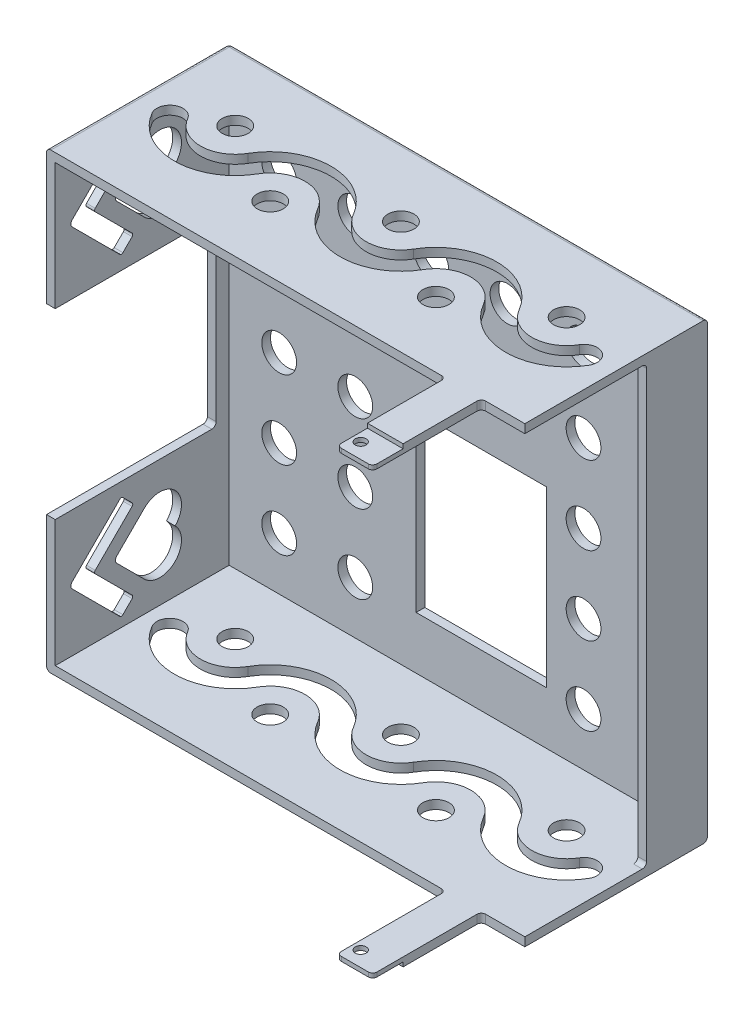
from build123d import *

# Parameters (mm, degrees)
SKETCH_5_W           = 115
SKETCH_5_H           = 104.2
EXTRUDE_2_DEPTH      = 42
SHELL_1_T            = -2
CUT_EXTRUDE_5_REACH  = 135.054
SKETCH_6_W           = 37
SKETCH_6_H           = 42
SKETCH_8_W           = 30
SKETCH_8_H           = 49
CUT_EXTRUDE_6_DEPTH  = 10
SKETCH_16_W          = 8.2
SKETCH_16_H          = 25
EXTRUDE_8_DEPTH      = 2
SKETCH_17_R          = 1.25
CUT_EXTRUDE_10_DEPTH = 10
SKETCH_18_W          = 8.2
SKETCH_18_H          = 7
CUT_EXTRUDE_11_DEPTH = 1
SKETCH_19_W          = 8.2
SKETCH_19_H          = 25
EXTRUDE_9_DEPTH      = 2
SKETCH_20_R          = 1.25
CUT_EXTRUDE_12_DEPTH = 2
SKETCH_21_W          = 8.2
SKETCH_21_H          = 7
CUT_EXTRUDE_13_DEPTH = 1
SKETCH_22_W          = 30
SKETCH_22_H          = 27
EXTRUDE_10_DEPTH     = 2
FILLET_2_R           = 1
EXTRUDE_13_DEPTH     = 2
FILLET_5_R           = 1
CUT_EXTRUDE_22_REACH = 147.339
CUT_EXTRUDE_24_REACH = 147.339
SKETCH_37_W          = 89.243695509
SKETCH_37_H          = 120
CUT_EXTRUDE_25_DEPTH = 5
SKETCH_38_W          = 30
SKETCH_38_H          = 40
CUT_EXTRUDE_26_DEPTH = 10
CUT_EXTRUDE_27_DEPTH = 137.575583469
SKETCH_39_R          = 3
CUT_EXTRUDE_28_DEPTH = 137.575583469
SKETCH_40_R          = 4
CUT_EXTRUDE_29_DEPTH = 103.516632797
SKETCH_41_W          = 12
SKETCH_41_H          = 100.2
EXTRUDE_14_DEPTH     = 2
FILLET_6_R           = 1
SKETCH_42_W          = 9.2
SKETCH_42_H          = 25
CUT_EXTRUDE_30_DEPTH = 137.575583469


with BuildPart() as part:
    # 草图5 → 凸台-拉伸2 (new body)
    with BuildSketch(Plane.XY):
        Rectangle(SKETCH_5_W, SKETCH_5_H)
    extrude(amount=EXTRUDE_2_DEPTH)

    # 抽壳1
    shell_1_openings = [part.faces().sort_by_distance(p)[0] for p in [
        (0, 0, 42),
    ]]
    offset(amount=SHELL_1_T, openings=shell_1_openings, kind=Kind.INTERSECTION)

    # 草图6 → 切除-拉伸5 (cut, up to next)
    with BuildSketch(Plane.ZY.offset(57.5), mode=Mode.PRIVATE) as cut_extrude_5_sk1:
        with Locations((23.5, 0)):
            Rectangle(SKETCH_6_W, SKETCH_6_H)
    cut_extrude_5_tool1 = extrude(cut_extrude_5_sk1.sketch, amount=-CUT_EXTRUDE_5_REACH, mode=Mode.PRIVATE) & part.part
    add(cut_extrude_5_tool1.solids().sort_by_distance((-57.5, 0, 23.5))[0], mode=Mode.SUBTRACT)

    # 草图8 → 切除-拉伸6 (cut)
    with BuildSketch(Plane(origin=(57.5, 0, 0), x_dir=(0, 0, -1), z_dir=(1, 0, 0))):
        with Locations((-26, -21.6)):
            Rectangle(SKETCH_8_W, SKETCH_8_H)
    extrude(amount=-CUT_EXTRUDE_6_DEPTH, mode=Mode.SUBTRACT)

    # 草图16 → 凸台-拉伸8 (add)
    with BuildSketch(Plane(origin=(0, 52.1, 0), x_dir=(1, 0, 0), z_dir=(0, 1, 0))):
        with Locations((-53.4, -54.5)):
            Rectangle(SKETCH_16_W, SKETCH_16_H)
    extrude_8 = extrude(amount=-EXTRUDE_8_DEPTH)

    # 草图17 → 切除-拉伸10 (cut)
    with BuildSketch(Plane(origin=(0, 52.1, 0), x_dir=(1, 0, 0), z_dir=(0, 1, 0))):
        with Locations(Location((-51.25, -63.5, 0), (0, 0, 270))):
            Circle(SKETCH_17_R)
    cut_extrude_10 = extrude(amount=-CUT_EXTRUDE_10_DEPTH, mode=Mode.SUBTRACT)

    # 草图18 → 切除-拉伸11 (cut)
    with BuildSketch(Plane(origin=(0, 52.1, 0), x_dir=(1, 0, 0), z_dir=(0, 1, 0))):
        with Locations((-53.4, -63.5)):
            Rectangle(SKETCH_18_W, SKETCH_18_H)
    cut_extrude_11 = extrude(amount=-CUT_EXTRUDE_11_DEPTH, mode=Mode.SUBTRACT)

    # 草图19 → 凸台-拉伸9 (add)
    with BuildSketch(Plane(origin=(0, 52.1, 0), x_dir=(1, 0, 0), z_dir=(0, 1, 0))):
        with Locations((38.4, -54.5)):
            Rectangle(SKETCH_19_W, SKETCH_19_H)
    extrude_9 = extrude(amount=-EXTRUDE_9_DEPTH)

    # 草图20 → 切除-拉伸12 (cut)
    with BuildSketch(Plane(origin=(0, 52.1, 0), x_dir=(1, 0, 0), z_dir=(0, 1, 0))):
        with Locations(Location((36.25, -63.5, 0), (0, 0, 270))):
            Circle(SKETCH_20_R)
    cut_extrude_12 = extrude(amount=-CUT_EXTRUDE_12_DEPTH, mode=Mode.SUBTRACT)

    # 草图21 → 切除-拉伸13 (cut)
    with BuildSketch(Plane(origin=(0, 52.1, 0), x_dir=(1, 0, 0), z_dir=(0, 1, 0))):
        with Locations((38.4, -63.5)):
            Rectangle(SKETCH_21_W, SKETCH_21_H)
    cut_extrude_13 = extrude(amount=-CUT_EXTRUDE_13_DEPTH, mode=Mode.SUBTRACT)

    # 镜向3: 凸台-拉伸8, 切除-拉伸10, 切除-拉伸11, 凸台-拉伸9, 切除-拉伸12, 切除-拉伸13 across plane
    add(extrude_8.mirror(Plane.ZX))
    add(cut_extrude_10.mirror(Plane.ZX), mode=Mode.SUBTRACT)
    add(cut_extrude_11.mirror(Plane.ZX), mode=Mode.SUBTRACT)
    add(extrude_9.mirror(Plane.ZX))
    add(cut_extrude_12.mirror(Plane.ZX), mode=Mode.SUBTRACT)
    add(cut_extrude_13.mirror(Plane.ZX), mode=Mode.SUBTRACT)

    # 草图22 → 凸台-拉伸10 (add)
    with BuildSketch(Plane(origin=(57.5, 0, 0), x_dir=(0, 0, -1), z_dir=(1, 0, 0))):
        with Locations((-57, 38.6)):
            Rectangle(SKETCH_22_W, SKETCH_22_H)
        with Locations((-57, -38.6)):
            Rectangle(SKETCH_22_W, SKETCH_22_H)
    extrude(amount=-EXTRUDE_10_DEPTH)

    # 圆角2
    fillet_2_edges = [part.edges().sort_by_distance(p)[0] for p in [
        (-56.5, -50.1, 42),
        (-56.5, 50.1, 42),
    ]]
    fillet(fillet_2_edges, radius=FILLET_2_R)

    # 草图26 → 凸台-拉伸13 (add)
    with BuildSketch(Plane(origin=(57.5, 0, 0), x_dir=(0, 0, -1), z_dir=(1, 0, 0))):
        with BuildLine():
            Line((-72, 25.1), (-42, 25.1))
            Line((-42, 25.1), (-42, -25.1))
            Line((-42, -25.1), (-72, -25.1))
            ThreePointArc((-72, -25.1), (-46.9, 0), (-72, 25.1))
        make_face()
    extrude(amount=-EXTRUDE_13_DEPTH)

    # 圆角5
    fillet_5_edges = [part.edges().sort_by_distance(p)[0] for p in [
        (0, 52.1, 0),
        (-57.5, 0, 0),
        (0, -52.1, 0),
        (57.5, 0, 0),
        (57.5, -52.1, 36),
        (57.5, 52.1, 36),
        (-57.5, 52.1, 30),
        (-57.5, -52.1, 30),
        (56.5, -25.1, 72),
        (56.5, 25.1, 72),
        (56.5, -46.1, 41),
        (56.5, 2.9, 41),
        (56.5, -46.1, 11),
        (56.5, 2.9, 11),
        (-56.5, 21, 5),
        (-56.5, -21, 5),
        (-49.3, 50.6, 67),
        (-57.5, 50.6, 67),
        (42.5, 50.6, 67),
        (34.3, 50.6, 67),
        (-49.3, -50.6, 67),
        (-57.5, -50.6, 67),
        (34.3, -50.6, 67),
        (42.5, -50.6, 67),
        (42.5, -51.1, 42),
        (34.3, -51.1, 42),
        (-49.3, -51.1, 42),
        (42.5, 51.1, 42),
        (34.3, 51.1, 42),
        (-49.3, 51.1, 42),
    ]]
    fillet(fillet_5_edges, radius=FILLET_5_R)

    # 草图34 → 切除-拉伸22 (cut, up to next)
    with BuildSketch(Plane.ZY.offset(57.5), mode=Mode.PRIVATE) as cut_extrude_22_sk1:
        with BuildLine():
            ThreePointArc((14.428932188, 36.05), (14.428932188, 43.121067812), (21.5, 43.121067812))
            Line((21.5, 43.121067812), (14.428932188, 36.05))
        make_face()
    cut_extrude_22_tool1 = extrude(cut_extrude_22_sk1.sketch, amount=-CUT_EXTRUDE_22_REACH, mode=Mode.PRIVATE) & part.part
    # 草图34 → 切除-拉伸22 (cut, up to next)
    with BuildSketch(Plane.ZY.offset(57.5), mode=Mode.PRIVATE) as cut_extrude_22_sk2:
        with BuildLine():
            Line((14.428932188, 36.05), (21.5, 28.978932188))
            ThreePointArc((21.5, 28.978932188), (14.428932188, 28.978932188), (14.428932188, 36.05))
        make_face()
    cut_extrude_22_tool2 = extrude(cut_extrude_22_sk2.sketch, amount=-CUT_EXTRUDE_22_REACH, mode=Mode.PRIVATE) & part.part
    # 草图34 → 切除-拉伸22 (cut, up to next)
    with BuildSketch(Plane.ZY.offset(57.5), mode=Mode.PRIVATE) as cut_extrude_22_sk3:
        with BuildLine():
            ThreePointArc((27.863961031, 36.757106781), (28.156854249, 36.05), (27.863961031, 35.342893219))
            Line((27.863961031, 35.342893219), (21.5, 28.978932188))
            Line((21.5, 28.978932188), (14.428932188, 36.05))
            Line((14.428932188, 36.05), (21.5, 43.121067812))
            Line((21.5, 43.121067812), (27.863961031, 36.757106781))
        make_face()
    cut_extrude_22_tool3 = extrude(cut_extrude_22_sk3.sketch, amount=-CUT_EXTRUDE_22_REACH, mode=Mode.PRIVATE) & part.part
    # 草图34 → 切除-拉伸22 (cut, up to next)
    with BuildSketch(Plane.ZY.offset(57.5), mode=Mode.PRIVATE) as cut_extrude_22_sk4:
        with BuildLine():
            ThreePointArc((27.863961031, -35.342893219), (28.156854249, -36.05), (27.863961031, -36.757106781))
            Line((27.863961031, -36.757106781), (21.5, -43.121067812))
            Line((21.5, -43.121067812), (14.428932188, -36.05))
            Line((14.428932188, -36.05), (21.5, -28.978932188))
            Line((21.5, -28.978932188), (27.863961031, -35.342893219))
        make_face()
    cut_extrude_22_tool4 = extrude(cut_extrude_22_sk4.sketch, amount=-CUT_EXTRUDE_22_REACH, mode=Mode.PRIVATE) & part.part
    # 草图34 → 切除-拉伸22 (cut, up to next)
    with BuildSketch(Plane.ZY.offset(57.5), mode=Mode.PRIVATE) as cut_extrude_22_sk5:
        with BuildLine():
            Line((21.5, -43.121067812), (14.428932188, -36.05))
            ThreePointArc((14.428932188, -36.05), (14.428932188, -43.121067812), (21.5, -43.121067812))
        make_face()
    cut_extrude_22_tool5 = extrude(cut_extrude_22_sk5.sketch, amount=-CUT_EXTRUDE_22_REACH, mode=Mode.PRIVATE) & part.part
    # 草图34 → 切除-拉伸22 (cut, up to next)
    with BuildSketch(Plane.ZY.offset(57.5), mode=Mode.PRIVATE) as cut_extrude_22_sk6:
        with BuildLine():
            ThreePointArc((14.428932188, -36.05), (14.428932188, -28.978932188), (21.5, -28.978932188))
            Line((21.5, -28.978932188), (14.428932188, -36.05))
        make_face()
    cut_extrude_22_tool6 = extrude(cut_extrude_22_sk6.sketch, amount=-CUT_EXTRUDE_22_REACH, mode=Mode.PRIVATE) & part.part
    add(cut_extrude_22_tool1.solids().sort_by_distance((-57.5, 41.086061, 16.463939))[0], mode=Mode.SUBTRACT)
    add(cut_extrude_22_tool2.solids().sort_by_distance((-57.5, 31.013939, 16.463939))[0], mode=Mode.SUBTRACT)
    add(cut_extrude_22_tool3.solids().sort_by_distance((-57.5, 36.05, 21.485472))[0], mode=Mode.SUBTRACT)
    add(cut_extrude_22_tool4.solids().sort_by_distance((-57.5, -36.05, 21.485472))[0], mode=Mode.SUBTRACT)
    add(cut_extrude_22_tool5.solids().sort_by_distance((-57.5, -41.086061, 16.463939))[0], mode=Mode.SUBTRACT)
    add(cut_extrude_22_tool6.solids().sort_by_distance((-57.5, -31.013939, 16.463939))[0], mode=Mode.SUBTRACT)

    # 草图36 → 切除-拉伸24 (cut, up to next)
    with BuildSketch(Plane.ZY.offset(57.5), mode=Mode.PRIVATE) as cut_extrude_24_sk1:
        with BuildLine():
            Line((24.318019485, -26.504058454), (26.439339828, -24.38273811))
            ThreePointArc((26.439339828, -24.38273811), (26.792893219, -24.236291501), (27.146446609, -24.38273811))
            Line((27.146446609, -24.38273811), (38.106601718, -35.342893219))
            ThreePointArc((38.106601718, -35.342893219), (38.399494937, -36.05), (38.106601718, -36.757106781))
            Line((38.106601718, -36.757106781), (27.146446609, -47.71726189))
            ThreePointArc((27.146446609, -47.71726189), (26.792893219, -47.863708499), (26.439339828, -47.71726189))
            Line((26.439339828, -47.71726189), (24.318019485, -45.595941546))
            ThreePointArc((24.318019485, -45.595941546), (24.171572875, -45.242388155), (24.318019485, -44.888834765))
            Line((24.318019485, -44.888834765), (32.803300859, -36.403553391))
            ThreePointArc((32.803300859, -36.403553391), (32.949747468, -36.05), (32.803300859, -35.696446609))
            Line((32.803300859, -35.696446609), (24.318019485, -27.211165235))
            ThreePointArc((24.318019485, -27.211165235), (24.171572875, -26.857611845), (24.318019485, -26.504058454))
        make_face()
    cut_extrude_24_tool1 = extrude(cut_extrude_24_sk1.sketch, amount=-CUT_EXTRUDE_24_REACH, mode=Mode.PRIVATE) & part.part
    # 草图36 → 切除-拉伸24 (cut, up to next)
    with BuildSketch(Plane.ZY.offset(57.5), mode=Mode.PRIVATE) as cut_extrude_24_sk2:
        with BuildLine():
            Line((24.318019485, 45.595941546), (26.439339828, 47.71726189))
            ThreePointArc((26.439339828, 47.71726189), (26.792893219, 47.863708499), (27.146446609, 47.71726189))
            Line((27.146446609, 47.71726189), (38.106601718, 36.757106781))
            ThreePointArc((38.106601718, 36.757106781), (38.399494937, 36.05), (38.106601718, 35.342893219))
            Line((38.106601718, 35.342893219), (27.146446609, 24.38273811))
            ThreePointArc((27.146446609, 24.38273811), (26.792893219, 24.236291501), (26.439339828, 24.38273811))
            Line((26.439339828, 24.38273811), (24.318019485, 26.504058454))
            ThreePointArc((24.318019485, 26.504058454), (24.171572875, 26.857611845), (24.318019485, 27.211165235))
            Line((24.318019485, 27.211165235), (32.803300859, 35.696446609))
            ThreePointArc((32.803300859, 35.696446609), (32.949747468, 36.05), (32.803300859, 36.403553391))
            Line((32.803300859, 36.403553391), (24.318019485, 44.888834765))
            ThreePointArc((24.318019485, 44.888834765), (24.171572875, 45.242388155), (24.318019485, 45.595941546))
        make_face()
    cut_extrude_24_tool2 = extrude(cut_extrude_24_sk2.sketch, amount=-CUT_EXTRUDE_24_REACH, mode=Mode.PRIVATE) & part.part
    add(cut_extrude_24_tool1.solids().sort_by_distance((-57.5, -25.638422, 25.573704))[0], mode=Mode.SUBTRACT)
    add(cut_extrude_24_tool2.solids().sort_by_distance((-57.5, 46.461578, 25.573704))[0], mode=Mode.SUBTRACT)

    # 草图37 → 切除-拉伸25 (cut)
    with BuildSketch(Plane(origin=(57.5, 0, 0), x_dir=(0, 0, -1), z_dir=(1, 0, 0))):
        with Locations((-37.487394926, 0.022986989)):
            Rectangle(SKETCH_37_W, SKETCH_37_H)
    extrude(amount=-CUT_EXTRUDE_25_DEPTH, mode=Mode.SUBTRACT)

    # 草图38 → 切除-拉伸26 (cut)
    with BuildSketch(Plane(origin=(0, 0, 0), x_dir=(-1, 0, 0), z_dir=(0, 0, -1))):
        with Locations((-2.5, -18)):
            Rectangle(SKETCH_38_W, SKETCH_38_H)
    extrude(amount=-CUT_EXTRUDE_26_DEPTH, mode=Mode.SUBTRACT)

    # 草图29 → 切除-拉伸27 (cut, through all)
    with BuildSketch(Plane.XZ.offset(52.1)):
        with BuildLine():
            ThreePointArc((-27.984482672, 23), (-40.108838325, 30), (-52.233193978, 23))
            ThreePointArc((-52.233193978, 23), (-51.135117767, 18.901923789), (-47.037041555, 20))
            ThreePointArc((-47.037041555, 20), (-40.108838325, 24), (-33.180635095, 20))
            ThreePointArc((-33.180635095, 20), (-21.056279442, 13), (-8.931923789, 20))
            ThreePointArc((-8.931923789, 20), (-10.03, 24.098076211), (-14.128076211, 23))
            ThreePointArc((-14.128076211, 23), (-21.056279442, 19), (-27.984482672, 23))
        make_face()
        with BuildLine():
            ThreePointArc((10.124355653, 23), (-2, 30), (-14.124355653, 23))
            ThreePointArc((-14.124355653, 23), (-13.026279442, 18.901923789), (-8.92820323, 20))
            ThreePointArc((-8.92820323, 20), (-2, 24), (4.92820323, 20))
            ThreePointArc((4.92820323, 20), (17.052558883, 13), (29.176914536, 20))
            ThreePointArc((29.176914536, 20), (36.105117767, 24), (43.033320997, 20))
            ThreePointArc((43.033320997, 20), (47.131397208, 18.901923789), (48.229473419, 23))
            ThreePointArc((48.229473419, 23), (36.105117767, 30), (23.980762114, 23))
            ThreePointArc((23.980762114, 23), (17.052558883, 19), (10.124355653, 23))
        make_face()
    extrude(amount=-CUT_EXTRUDE_27_DEPTH, mode=Mode.SUBTRACT)

    # 草图39 → 切除-拉伸28 (cut, through all)
    with BuildSketch(Plane(origin=(0, 52.1, 0), x_dir=(1, 0, 0), z_dir=(0, 1, 0))):
        with Locations(Location((-40.108838325, -16, 0), (0, 0, 270))):
            Circle(SKETCH_39_R)
        with Locations(Location((-21.056279442, -27, 0), (0, 0, 270))):
            Circle(SKETCH_39_R)
        with Locations(Location((-2, -16, 0), (0, 0, 270))):
            Circle(SKETCH_39_R)
        with Locations(Location((17.052558883, -27, 0), (0, 0, 270))):
            Circle(SKETCH_39_R)
        with Locations(Location((36.105117767, -16, 0), (0, 0, 270))):
            Circle(SKETCH_39_R)
    extrude(amount=-CUT_EXTRUDE_28_DEPTH, mode=Mode.SUBTRACT)

    # 草图40 → 切除-拉伸29 (cut, through all)
    with BuildSketch(Plane(origin=(0, 0, 0), x_dir=(-1, 0, 0), z_dir=(0, 0, -1))):
        with Locations((-43.5, -38)):
            Circle(SKETCH_40_R)
        with Locations((-26, -38)):
            Circle(SKETCH_40_R)
        with Locations((26.5, -38)):
            Circle(SKETCH_40_R)
        with Locations((44, -38)):
            Circle(SKETCH_40_R)
        with Locations((-26, -20)):
            Circle(SKETCH_40_R)
        with Locations((26.5, -20)):
            Circle(SKETCH_40_R)
        with Locations((44, -20)):
            Circle(SKETCH_40_R)
        with Locations((-26, -2)):
            Circle(SKETCH_40_R)
        with Locations((26.5, -2)):
            Circle(SKETCH_40_R)
        with Locations((44, -2)):
            Circle(SKETCH_40_R)
        with Locations((-26, 16)):
            Circle(SKETCH_40_R)
        with Locations((-8.5, 16)):
            Circle(SKETCH_40_R)
        with Locations((9, 16)):
            Circle(SKETCH_40_R)
        with Locations((26.5, 16)):
            Circle(SKETCH_40_R)
        with Locations((44, 16)):
            Circle(SKETCH_40_R)
        with Locations((-26, 34)):
            Circle(SKETCH_40_R)
        with Locations((-8.5, 34)):
            Circle(SKETCH_40_R)
        with Locations((9, 34)):
            Circle(SKETCH_40_R)
        with Locations((26.5, 34)):
            Circle(SKETCH_40_R)
        with Locations((44, 34)):
            Circle(SKETCH_40_R)
        with Locations((-43.5, -20)):
            Circle(SKETCH_40_R)
        with Locations((-43.5, -2)):
            Circle(SKETCH_40_R)
        with Locations((-43.5, 16)):
            Circle(SKETCH_40_R)
        with Locations((-43.5, 34)):
            Circle(SKETCH_40_R)
    extrude(amount=-CUT_EXTRUDE_29_DEPTH, mode=Mode.SUBTRACT)

    # 草图41 → 凸台-拉伸14 (add)
    with BuildSketch(Plane(origin=(52.5, 0, 0), x_dir=(0, 0, -1), z_dir=(1, 0, 0))):
        with Locations((-8, 0)):
            Rectangle(SKETCH_41_W, SKETCH_41_H)
    extrude(amount=-EXTRUDE_14_DEPTH)

    # 圆角6
    fillet_6_edges = [part.edges().sort_by_distance(p)[0] for p in [
        (51.5, -50.1, 14),
        (51.5, 50.1, 14),
    ]]
    fillet(fillet_6_edges, radius=FILLET_6_R)

    # 草图42 → 切除-拉伸30 (cut, through all)
    with BuildSketch(Plane(origin=(0, 52.1, 0), x_dir=(1, 0, 0), z_dir=(0, 1, 0))):
        with Locations((-52.9, -54.5)):
            Rectangle(SKETCH_42_W, SKETCH_42_H)
    extrude(amount=-CUT_EXTRUDE_30_DEPTH, mode=Mode.SUBTRACT)


solid = part.part
